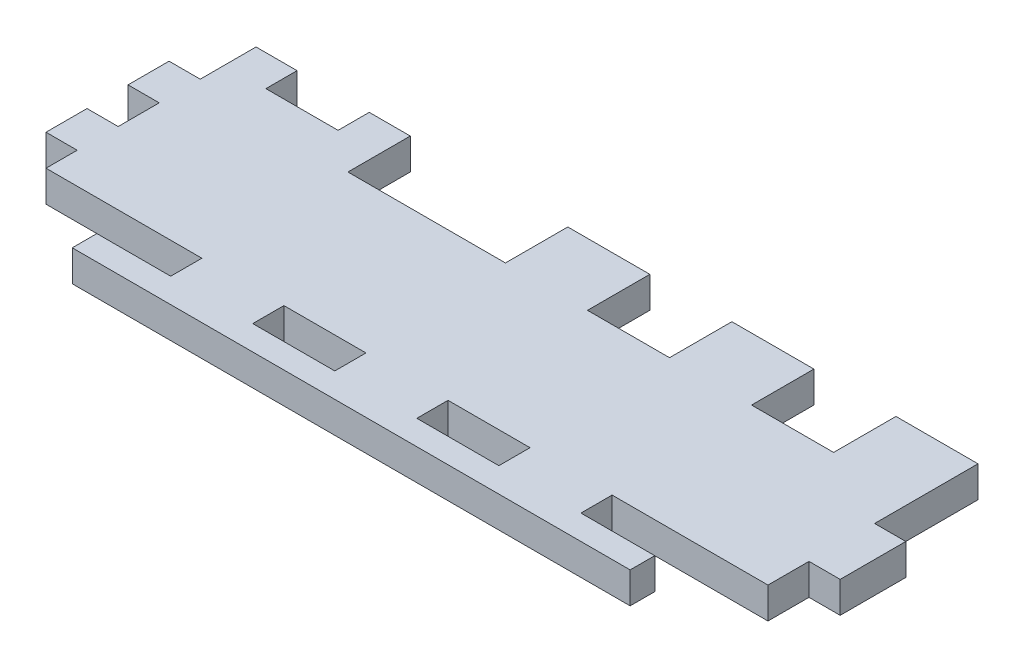
from build123d import *

# Parameters (mm, degrees)
SKETCH1_W           = 88
SKETCH1_H           = 18
BOSS_EXTRUDE1_DEPTH = 3.8
SKETCH2_W           = 18.8
SKETCH2_H           = 3.8
BOSS_EXTRUDE2_DEPTH = 3.8
SKETCH3_W           = 10
SKETCH3_H           = 3.8
BOSS_EXTRUDE3_DEPTH = 3.8
LPATTERN1_COUNT     = 3
LPATTERN1_PITCH     = 20
LPATTERN1_COL_COUNT = 3
LPATTERN1_COL_PITCH = 20
SKETCH4_W           = 1
SKETCH4_H           = 3.8
CUT_EXTRUDE1_DEPTH  = 92.709759568
SKETCH5_W           = 88
SKETCH5_H           = 3
BOSS_EXTRUDE4_DEPTH = 3.8
SKETCH6_W           = 5
SKETCH6_H           = 3.8
BOSS_EXTRUDE5_DEPTH = 3.8
SKETCH7_W           = 10
SKETCH7_H           = 7.6
BOSS_EXTRUDE6_DEPTH = 3.8
LPATTERN2_COUNT     = 3
LPATTERN2_PITCH     = 20
SKETCH9_W           = 9
SKETCH9_H           = 3.8
CUT_EXTRUDE2_DEPTH  = 92.506721065
SKETCH10_W          = 3.8
SKETCH10_H          = 5
SKETCH10_H_2        = 8
BOSS_EXTRUDE8_DEPTH = 3.8
SKETCH11_W          = 10
SKETCH11_H          = 3
CUT_EXTRUDE3_DEPTH  = 96.166800934


with BuildPart() as part:
    # Sketch1 → Boss-Extrude1 (new body)
    with BuildSketch(Plane(origin=(0, 0, 0), x_dir=(1, 0, 0), z_dir=(0, 1, 0))):
        with Locations((44, -9)):
            Rectangle(SKETCH1_W, SKETCH1_H)
    extrude(amount=BOSS_EXTRUDE1_DEPTH)

    # Sketch2 → Boss-Extrude2 (add, through all)
    with BuildSketch(Plane.XZ):
        with Locations((9.4, -1.9)):
            Rectangle(SKETCH2_W, SKETCH2_H)
    extrude(amount=-BOSS_EXTRUDE2_DEPTH)

    # Sketch3 → Boss-Extrude3 (add, through all)
    with BuildSketch(Plane.XZ):
        with Locations((44, 19.9)):
            Rectangle(SKETCH3_W, SKETCH3_H)
    boss_extrude3 = extrude(amount=-BOSS_EXTRUDE3_DEPTH)

    # LPattern1: Boss-Extrude3 ×3
    with Locations(*[(i * LPATTERN1_PITCH, 0, 0) for i in range(1, LPATTERN1_COUNT)]):
        add(boss_extrude3)

    # LPattern1 col: Boss-Extrude3 ×3
    with Locations(*[(-i * LPATTERN1_COL_PITCH, 0, 0) for i in range(1, LPATTERN1_COL_COUNT)]):
        add(boss_extrude3)

    # Sketch4 → Cut-Extrude1 (cut, through all)
    with BuildSketch(Plane(origin=(0, 0, 0), x_dir=(-1, 0, 0), z_dir=(0, -1, 0))):
        with Locations((0.5, -19.9)):
            Rectangle(SKETCH4_W, SKETCH4_H)
        with Locations((-88.5, -19.9)):
            Rectangle(SKETCH4_W, SKETCH4_H)
    extrude(amount=-CUT_EXTRUDE1_DEPTH, mode=Mode.SUBTRACT)

    # Sketch5 → Boss-Extrude4 (add, through all)
    with BuildSketch(Plane(origin=(0, 0, 0), x_dir=(-1, 0, 0), z_dir=(0, -1, 0))):
        with Locations((-44, -23.3)):
            Rectangle(SKETCH5_W, SKETCH5_H)
    extrude(amount=-BOSS_EXTRUDE4_DEPTH)

    # Sketch6 → Boss-Extrude5 (add, through all)
    with BuildSketch(Plane(origin=(0, 0, 0), x_dir=(-1, 0, 0), z_dir=(0, -1, 0))):
        with Locations((-2.5, 5.7)):
            Rectangle(SKETCH6_W, SKETCH6_H)
        with Locations((-16.3, 5.7)):
            Rectangle(SKETCH6_W, SKETCH6_H)
    extrude(amount=-BOSS_EXTRUDE5_DEPTH)

    # Sketch7 → Boss-Extrude6 (add, through all)
    with BuildSketch(Plane(origin=(0, 0, 0), x_dir=(-1, 0, 0), z_dir=(0, -1, 0))):
        with Locations((-83, 3.8)):
            Rectangle(SKETCH7_W, SKETCH7_H)
    boss_extrude6 = extrude(amount=-BOSS_EXTRUDE6_DEPTH)

    # LPattern2: Boss-Extrude6 ×3
    with Locations(*[(-i * LPATTERN2_PITCH, 0, 0) for i in range(1, LPATTERN2_COUNT)]):
        add(boss_extrude6)

    # Sketch9 → Cut-Extrude2 (cut, through all)
    with BuildSketch(Plane(origin=(0, 0, 0), x_dir=(-1, 0, 0), z_dir=(0, -1, 0))):
        with Locations((-4.5, -19.9)):
            Rectangle(SKETCH9_W, SKETCH9_H)
        with Locations((-83.5, -19.9)):
            Rectangle(SKETCH9_W, SKETCH9_H)
    extrude(amount=-CUT_EXTRUDE2_DEPTH, mode=Mode.SUBTRACT)

    # Sketch10 → Boss-Extrude8 (add, through all)
    with BuildSketch(Plane(origin=(0, 0, 0), x_dir=(-1, 0, 0), z_dir=(0, -1, 0))):
        with Locations((1.9, -11.7)):
            Rectangle(SKETCH10_W, SKETCH10_H)
        with Locations((-89.9, -9)):
            Rectangle(SKETCH10_W, SKETCH10_H_2)
        with Locations((1.9, -1.7)):
            Rectangle(SKETCH10_W, SKETCH10_H)
    extrude(amount=-BOSS_EXTRUDE8_DEPTH)

    # Sketch11 → Cut-Extrude3 (cut, through all)
    with BuildSketch(Plane(origin=(0, 0, 0), x_dir=(-1, 0, 0), z_dir=(0, -1, 0))):
        with Locations((-5, -23.3)):
            Rectangle(SKETCH11_W, SKETCH11_H)
        with Locations((-83, -23.3)):
            Rectangle(SKETCH11_W, SKETCH11_H)
    extrude(amount=-CUT_EXTRUDE3_DEPTH, mode=Mode.SUBTRACT)


solid = part.part
